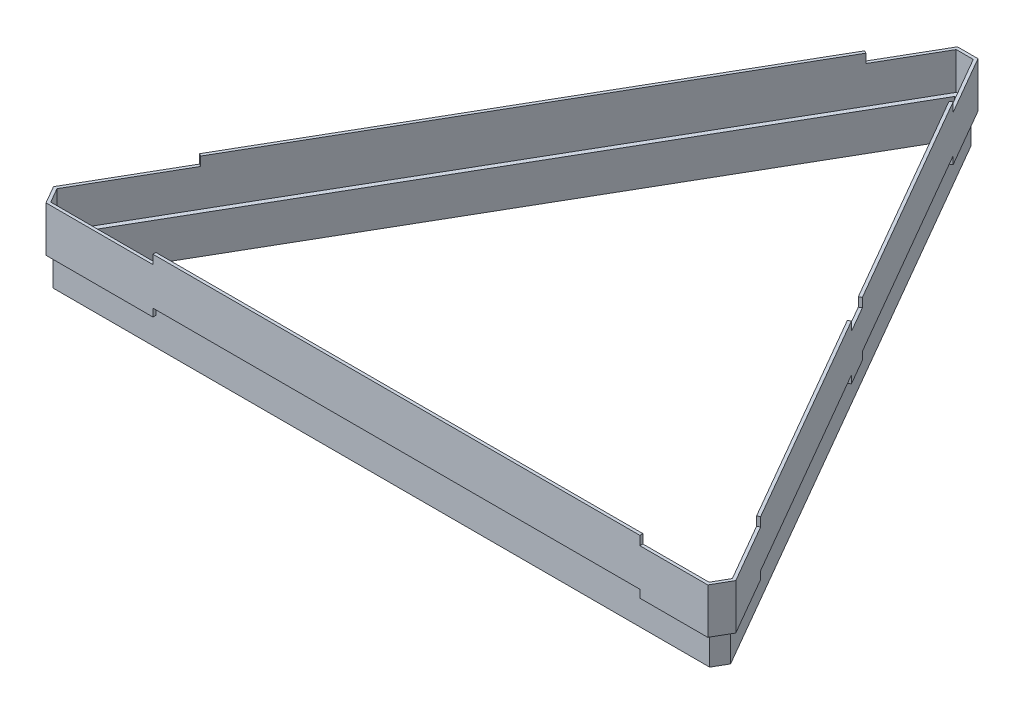
from build123d import *

# Parameters (mm, degrees)
BOSS_EXTRUDE1_DEPTH = 0.2
BOSS_EXTRUDE2_DEPTH = 12.58
SKETCH1_8_W         = 162.49
SKETCH1_8_H         = 1
BOSS_EXTRUDE3_DEPTH = 15.58
BOSS_EXTRUDE4_DEPTH = 12.38
BOSS_EXTRUDE5_DEPTH = 2.58


with BuildPart() as part:
    # Sketch1 → Boss-Extrude1 (new body)
    with BuildSketch(Plane(origin=(0, 0, 0), x_dir=(1, 0, 0), z_dir=(0, 1, 0))):
        Polygon((-113.845299462, 0), (-110.422649731, -5.92820323), (110.422649731, -5.92820323), (113.845299462, 0), (3.422649731, 191.25763964), (-3.422649731, 191.25763964), align=None)
        Polygon((-1.979274058, 188.75763964), (1.979274058, 188.75763964), (110.958548116, 0), (108.979274058, -3.42820323), (-108.979274058, -3.42820323), (-110.958548116, 0), align=None, mode=Mode.SUBTRACT)
    extrude(amount=BOSS_EXTRUDE1_DEPTH)

    # Sketch1<7> → Boss-Extrude2 (add)
    with BuildSketch(Plane(origin=(0, 0, 0), x_dir=(1, 0, 0), z_dir=(0, 1, 0))):
        Polygon((-95.137949192, 30.402081141), (-96.003974596, 30.902081141), (-113.845299462, 0), (-110.422649731, -5.92820323), (-74.74, -5.92820323), (-74.74, -4.92820323), (-109.845299462, -4.92820323), (-112.690598923, 0), align=None)
        Polygon((-3.422649731, 191.25763964), (-14.758974596, 171.622549002), (-13.892949192, 171.122549002), (-2.845299462, 190.25763964), (2.845299462, 190.25763964), (13.892949192, 171.122549002), (14.758974596, 171.622549002), (3.422649731, 191.25763964), align=None)
        Polygon((109.845299462, -4.92820323), (87.75, -4.92820323), (87.75, -5.92820323), (110.422649731, -5.92820323), (113.845299462, 0), (102.508974596, 19.635090638), (101.642949192, 19.135090638), (112.690598923, 0), align=None)
        Polygon((61.133974596, 91.298692801), (56.133974596, 99.958946839), (55.267949192, 99.458946839), (60.267949192, 90.798692801), align=None)
    extrude(amount=BOSS_EXTRUDE2_DEPTH)

    # Sketch1<8> → Boss-Extrude3 (add)
    with BuildSketch(Plane(origin=(0, 0, 0), x_dir=(1, 0, 0), z_dir=(0, 1, 0))):
        Polygon((-14.758974596, 171.622549002), (-96.003974596, 30.902081141), (-95.137949192, 30.402081141), (-13.892949192, 171.122549002), align=None)
        with Locations((6.505, -5.42820323)):
            Rectangle(SKETCH1_8_W, SKETCH1_8_H)
        Polygon((56.133974596, 99.958946839), (14.758974596, 171.622549002), (13.892949192, 171.122549002), (55.267949192, 99.458946839), align=None)
        Polygon((102.508974596, 19.635090638), (61.133974596, 91.298692801), (60.267949192, 90.798692801), (101.642949192, 19.135090638), align=None)
    extrude(amount=BOSS_EXTRUDE3_DEPTH)

    # Sketch1<9> → Boss-Extrude4 (add)
    with BuildSketch(Plane(origin=(0, 0, 0), x_dir=(1, 0, 0), z_dir=(0, 1, 0))):
        Polygon((-112.113248654, 0), (-110.834936491, -2.214101615), (-109.556624327, -4.42820323), (109.556624327, -4.42820323), (112.113248654, 0), (2.556624327, 189.75763964), (-2.556624327, 189.75763964), align=None)
        Polygon((-110.958548116, 0), (-56.468911087, 94.37881982), (-1.979274058, 188.75763964), (1.979274058, 188.75763964), (110.958548116, 0), (108.979274058, -3.42820323), (-108.979274058, -3.42820323), align=None, mode=Mode.SUBTRACT)
    extrude(amount=-BOSS_EXTRUDE4_DEPTH)

    # Sketch1<10> → Boss-Extrude5 (add)
    with BuildSketch(Plane(origin=(0, 0, 0), x_dir=(1, 0, 0), z_dir=(0, 1, 0))):
        Polygon((-95.137949192, 30.402081141), (-96.003974596, 30.902081141), (-113.845299462, 0), (-110.422649731, -5.92820323), (-74.74, -5.92820323), (-74.74, -4.92820323), (-109.845299462, -4.92820323), (-112.690598923, 0), align=None)
        Polygon((-3.422649731, 191.25763964), (-14.758974596, 171.622549002), (-13.892949192, 171.122549002), (-2.845299462, 190.25763964), (2.845299462, 190.25763964), (13.892949192, 171.122549002), (14.758974596, 171.622549002), (3.422649731, 191.25763964), align=None)
        Polygon((109.845299462, -4.92820323), (87.75, -4.92820323), (87.75, -5.92820323), (110.422649731, -5.92820323), (113.845299462, 0), (102.508974596, 19.635090638), (101.642949192, 19.135090638), (112.690598923, 0), align=None)
        Polygon((61.133974596, 91.298692801), (56.133974596, 99.958946839), (55.267949192, 99.458946839), (60.267949192, 90.798692801), align=None)
    extrude(amount=-BOSS_EXTRUDE5_DEPTH)


solid = part.part
